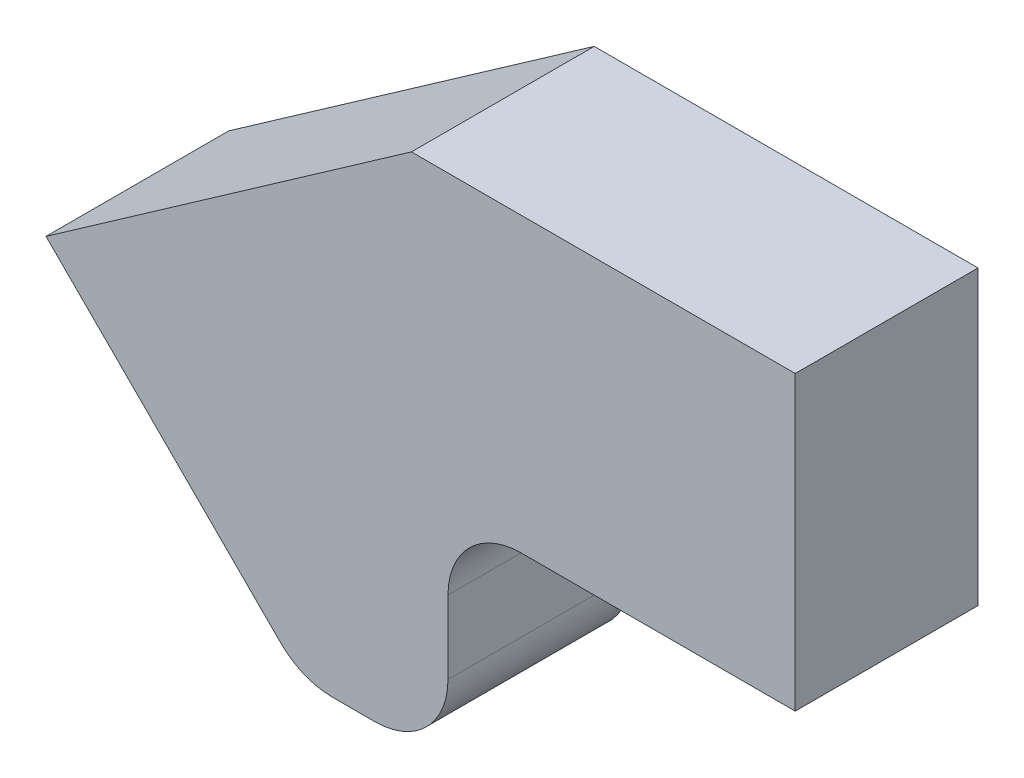
from build123d import *

# Parameters (mm, degrees)
BOSS_EXTRUDE1_DEPTH = 0.125
FILLET1_R           = 0.1


with BuildPart() as part:
    # frame_outline → Boss-Extrude1 (new, symmetric)
    with BuildSketch(Plane.XY):
        Polygon((0, 0), (0.499851802, 0.35), (1.024851802, 0.35), (1.024851802, -0.05), (0.549851802, -0.05), (0.549851802, -0.35), (0.35, -0.35), align=None)
    extrude(amount=BOSS_EXTRUDE1_DEPTH, both=True)

    # Fillet1
    fillet1_edges = [part.edges().sort_by_distance(p)[0] for p in [
        (0.549851802, -0.05, 0),
        (0.549851802, -0.35, 0),
        (0.35, -0.35, 0),
    ]]
    fillet(fillet1_edges, radius=FILLET1_R)


solid = part.part
